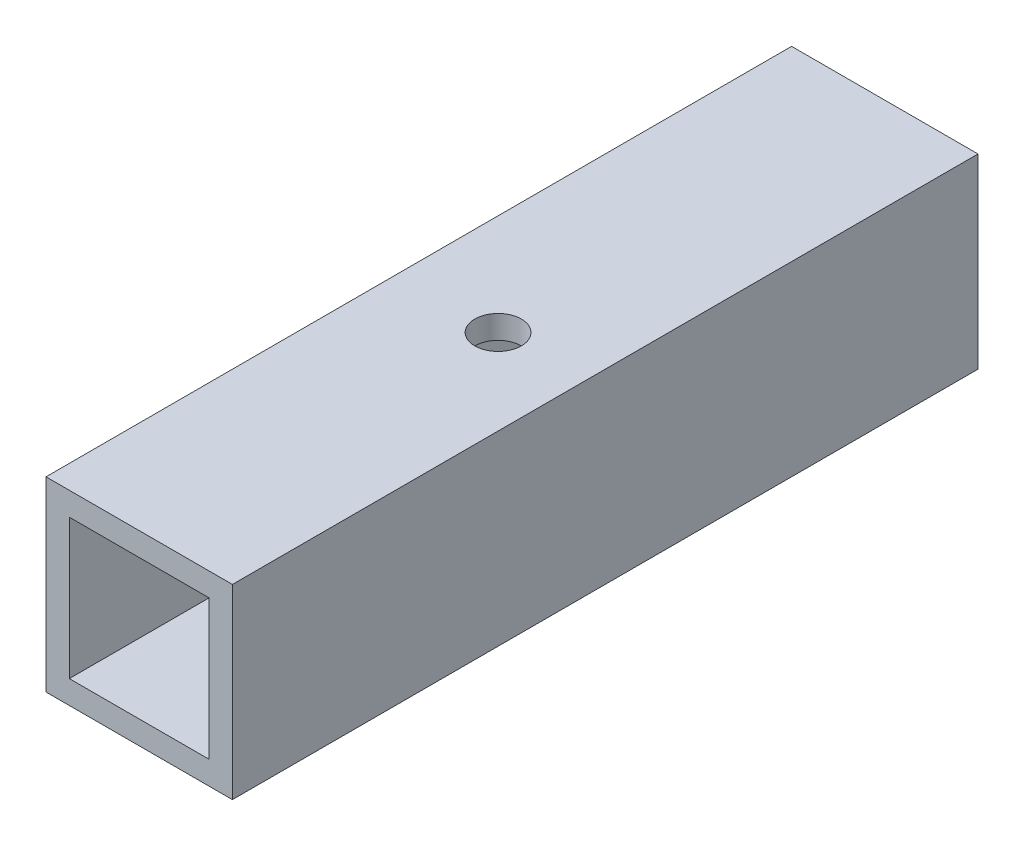
from build123d import *

# Parameters (mm, degrees)
SKETCH1_W           = 25.4
SKETCH1_H           = 25.4
SKETCH1_W_2         = 19.05
SKETCH1_H_2         = 19.05
BOSS_EXTRUDE1_DEPTH = 101.6
SKETCH2_RX          = 3.175
SKETCH2_RY          = 3.173642052
CUT_EXTRUDE1_DEPTH  = 101.6


with BuildPart() as part:
    # Sketch1 → Boss-Extrude1 (new body)
    with BuildSketch(Plane.XY):
        with Locations((12.7, 12.7)):
            Rectangle(SKETCH1_W, SKETCH1_H)
        with Locations((12.7, 12.7)):
            Rectangle(SKETCH1_W_2, SKETCH1_H_2, mode=Mode.SUBTRACT)
    extrude(amount=BOSS_EXTRUDE1_DEPTH)

    # Sketch2 → Cut-Extrude1 (cut)
    with BuildSketch(Plane(origin=(0, 25.4, 0), x_dir=(1, 0, 0), z_dir=(0, 1, 0))):
        with Locations(Location((13.766367438, -53.764427429), (0, 0, -36.863751169))):
            Ellipse(SKETCH2_RX, SKETCH2_RY)
    extrude(amount=-CUT_EXTRUDE1_DEPTH, mode=Mode.SUBTRACT)


solid = part.part
